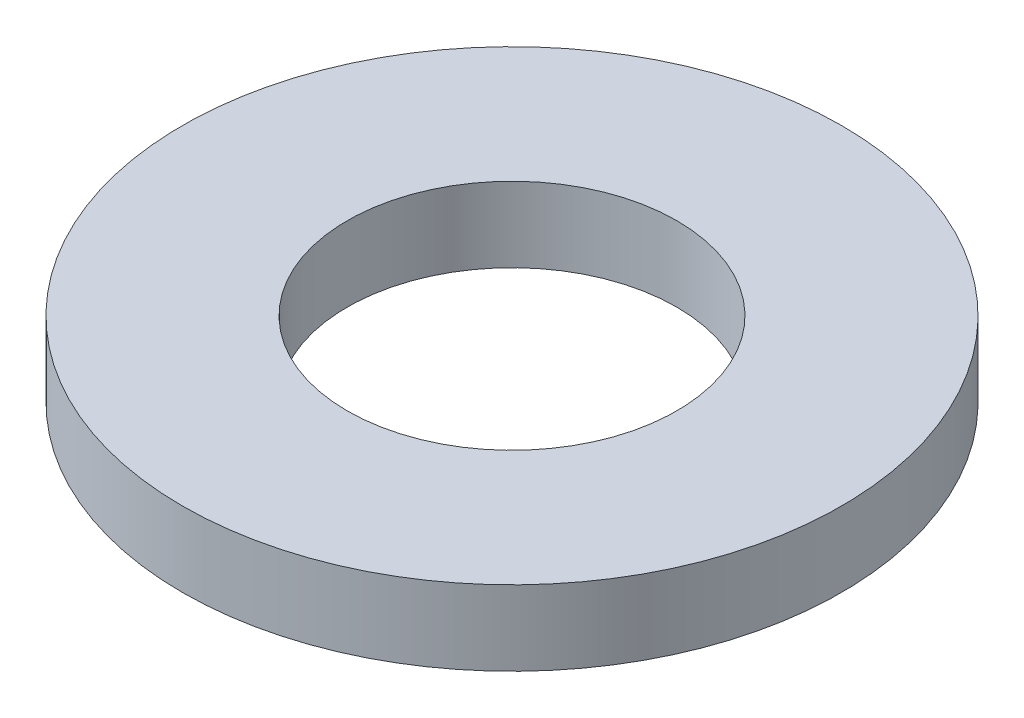
from build123d import *

# Parameters (mm, degrees)
SKETCH1_W = 55
SKETCH1_H = 25


with BuildPart() as part:
    # Sketch1 → Revolve1 (revolve)
    with BuildSketch(Plane.XY, mode=Mode.PRIVATE) as revolve1_sk:
        with Locations((82.5, 0)):
            Rectangle(SKETCH1_W, SKETCH1_H)
    revolve(revolve1_sk.sketch.rotate(Axis((0, 168.928571429, 0), (0, -1, 0)), 90), axis=Axis((0, 168.928571429, 0), (0, -1, 0)))


solid = part.part
